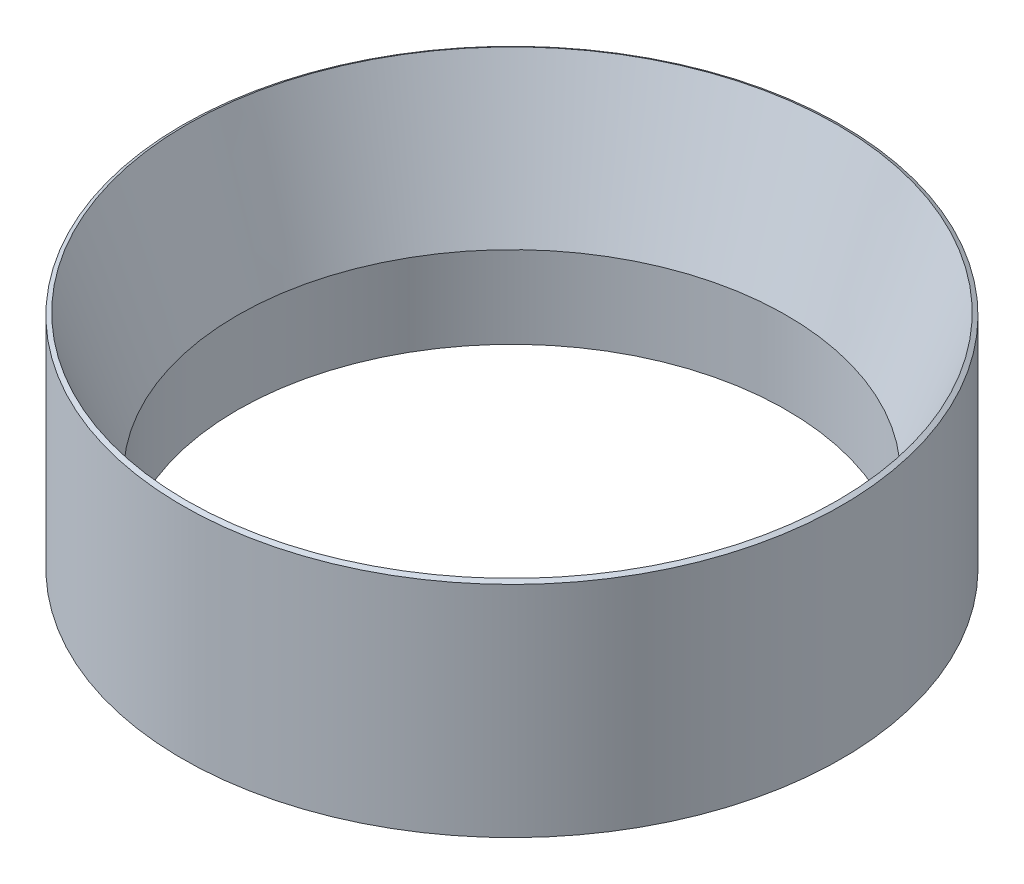
from build123d import *


with BuildPart() as part:
    # Sketch1 → Revolve1 (revolve)
    with BuildSketch(Plane.XY, mode=Mode.PRIVATE) as revolve1_sk:
        Polygon((42.545, 12.7), (50.419, 34.333637201), (51.054, 33.96701978), (51.054, 0), (42.545, 0), align=None)
    revolve(revolve1_sk.sketch.rotate(Axis((0, 36.078285362, 0), (0, -1, 0)), 180), axis=Axis((0, 36.078285362, 0), (0, -1, 0)))


solid = part.part
